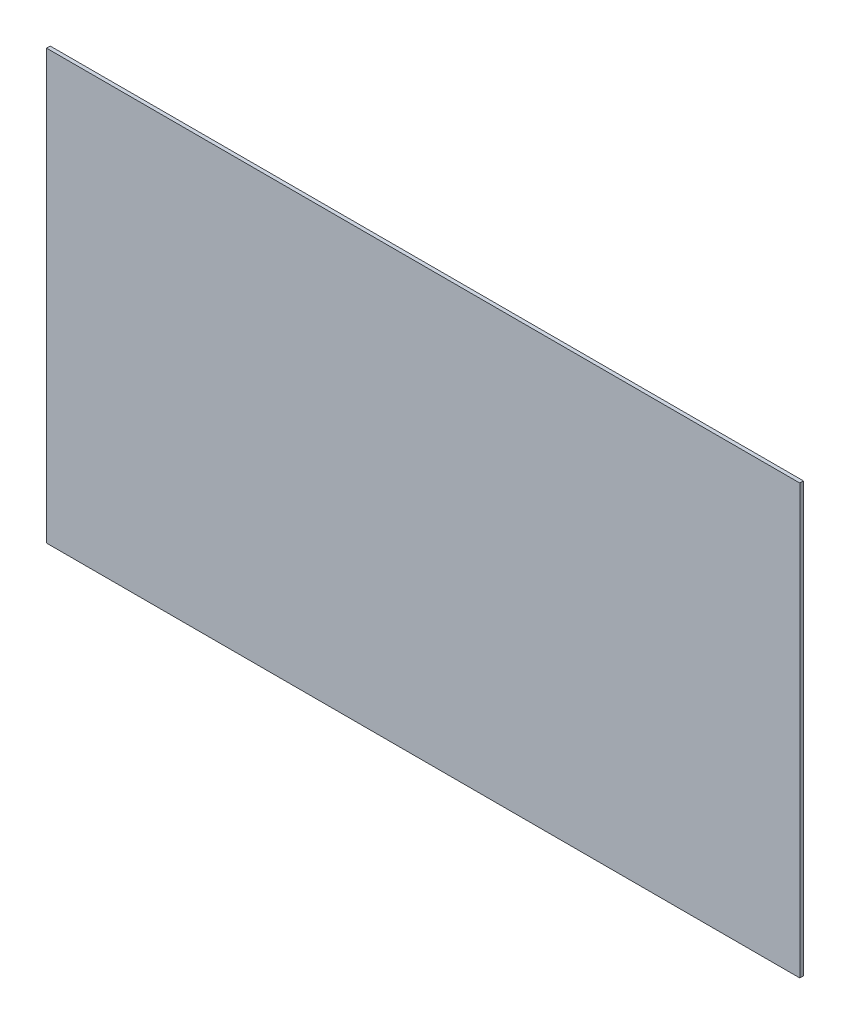
from build123d import *

# Parameters (mm, degrees)
SKETCH_1_W      = 615
SKETCH_1_H      = 350
EXTRUDE_1_DEPTH = 3


with BuildPart() as part:
    # 草图1 → 凸台-拉伸1 (new body)
    with BuildSketch(Plane.XY):
        with Locations((307.5, 175)):
            Rectangle(SKETCH_1_W, SKETCH_1_H)
    extrude(amount=EXTRUDE_1_DEPTH)


solid = part.part
